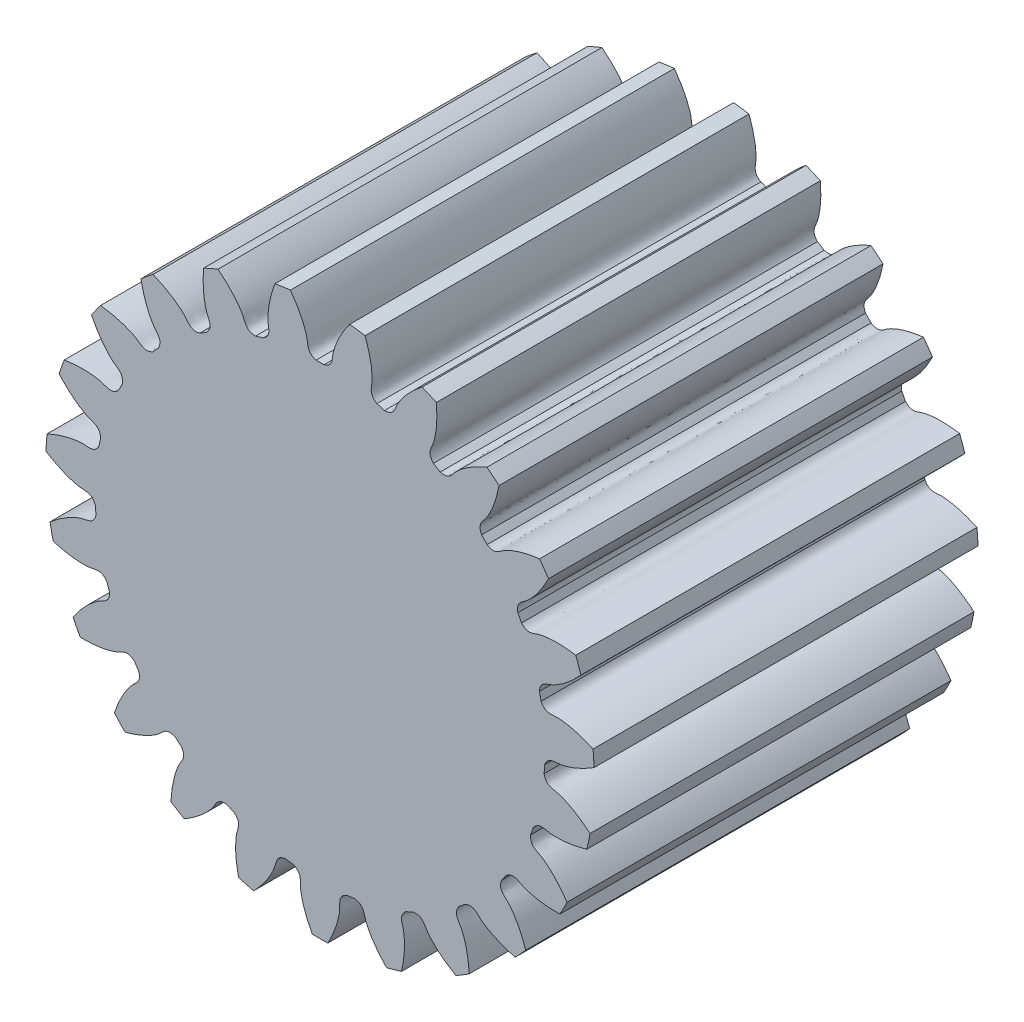
from build123d import *

# Parameters (mm, degrees)
SKETCH_1_R               = 12.5
EXTRUDE_1_DEPTH          = 30
CUT_EXTRUDE_1_DEPTH      = 35.820970693
PATTERN_CIRCULAR_1_COUNT = 23
SKETCH_4_R               = 23.884831792
CUT_EXTRUDE_2_DEPTH      = 12.5


with BuildPart() as part:
    # 草图1 → 凸台-拉伸1 (new body)
    with BuildSketch(Plane.XY):
        Circle(SKETCH_1_R)
    extrude(amount=EXTRUDE_1_DEPTH)

    # 草图2 → 切除-拉伸1 (cut, through all)
    with BuildSketch(Plane.XY):
        with BuildLine():
            ThreePointArc((0.181377653, 10.248395101), (0, 10.25), (-0.181377653, 10.248395101))
            add(Edge.make_bspline(
                [(-0.181377653, 10.248395101), (-0.577733486, 10.366762974), (-0.543760308, 10.63383717), (-0.592929934, 10.897175969), (-0.599497923, 10.928924648), (-0.607662079, 10.964750021), (-0.617581589, 11.004600593), (-0.629422247, 11.048418382), (-0.643345631, 11.096140951), (-0.659512363, 11.147700822), (-0.678080917, 11.203025719), (-0.699207817, 11.262038556), (-0.723047409, 11.324657509), (-0.749751766, 11.390796064), (-0.77947055, 11.460363083), (-0.812350892, 11.53326286), (-0.848537271, 11.609395193), (-0.888171388, 11.688655445), (-0.931392054, 11.77093462), (-0.978335067, 11.85611944), (-1.029133098, 11.944092416), (-1.083915577, 12.034731933), (-1.142808585, 12.127912332), (-1.205934738, 12.223503996), (-1.273413083, 12.321373437), (-1.345358995, 12.421383392), (-1.42188407, 12.523392912), (-1.503096023, 12.627257463), (-1.589098596, 12.732829022), (-1.679991457, 12.839956181), (-1.775870106, 12.94848425), (-1.876825788, 13.058255364), (-1.982945401, 13.169108593), (-2.094311412, 13.28088005), (-2.211001774, 13.393403009), (-2.333089845, 13.506508017), (-2.460644312, 13.620023012), (-2.59372912, 13.733773443), (-2.732403367, 13.847582394), (-2.927091206, 14.000950144), (-3.078290454, 14.112796156), (-3.181680766, 14.186195552)],
                knots=[0, 0, 0, 0, 0.147386897, 0.152959532, 0.159389495, 0.166676786, 0.174821406, 0.183823355, 0.193682632, 0.204399237, 0.21597317, 0.228404432, 0.241693023, 0.255838942, 0.270842189, 0.286702764, 0.303420668, 0.320995901, 0.339428462, 0.358718351, 0.378865568, 0.399870114, 0.421731989, 0.444451192, 0.468027723, 0.492461582, 0.517752771, 0.543901287, 0.570907132, 0.598770305, 0.627490807, 0.657068637, 0.687503795, 0.718796282, 0.750946098, 0.783953241, 0.817817713, 0.852539514, 0.888118643, 0.9245551, 1, 1, 1, 1], degree=3))
            ThreePointArc((-3.181680766, 14.186195552), (0, 14.538611926), (3.181680766, 14.186195552))
            add(Edge.make_bspline(
                [(0.181377653, 10.248395101), (0.577733486, 10.366762974), (0.543760308, 10.63383717), (0.592929934, 10.897175969), (0.599497923, 10.928924648), (0.607662079, 10.964750021), (0.617581589, 11.004600593), (0.629422247, 11.048418382), (0.643345631, 11.096140951), (0.659512363, 11.147700822), (0.678080917, 11.203025719), (0.699207817, 11.262038556), (0.723047409, 11.324657509), (0.749751766, 11.390796064), (0.77947055, 11.460363083), (0.812350892, 11.53326286), (0.848537271, 11.609395193), (0.888171388, 11.688655445), (0.931392054, 11.77093462), (0.978335067, 11.85611944), (1.029133098, 11.944092416), (1.083915577, 12.034731933), (1.142808585, 12.127912332), (1.205934738, 12.223503996), (1.273413083, 12.321373437), (1.345358995, 12.421383392), (1.42188407, 12.523392912), (1.503096023, 12.627257463), (1.589098596, 12.732829022), (1.679991457, 12.839956181), (1.775870106, 12.94848425), (1.876825788, 13.058255364), (1.982945401, 13.169108593), (2.094311412, 13.28088005), (2.211001774, 13.393403009), (2.333089845, 13.506508017), (2.460644312, 13.620023012), (2.59372912, 13.733773443), (2.732403367, 13.847582394), (2.927091206, 14.000950144), (3.078290454, 14.112796156), (3.181680766, 14.186195552)],
                knots=[0, 0, 0, 0, 0.147386897, 0.152959532, 0.159389495, 0.166676786, 0.174821406, 0.183823355, 0.193682632, 0.204399237, 0.21597317, 0.228404432, 0.241693023, 0.255838942, 0.270842189, 0.286702764, 0.303420668, 0.320995901, 0.339428462, 0.358718351, 0.378865568, 0.399870114, 0.421731989, 0.444451192, 0.468027723, 0.492461582, 0.517752771, 0.543901287, 0.570907132, 0.598770305, 0.627490807, 0.657068637, 0.687503795, 0.718796282, 0.750946098, 0.783953241, 0.817817713, 0.852539514, 0.888118643, 0.9245551, 1, 1, 1, 1], degree=3))
        make_face()
    cut_extrude_1 = extrude(amount=CUT_EXTRUDE_1_DEPTH, mode=Mode.SUBTRACT)

    # 阵列(圆周)1: 切除-拉伸1 ×23 about axis
    pattern_circular_1_axis = Axis((0, 0, -1.5), (0, 0, 1))
    for i in range(1, PATTERN_CIRCULAR_1_COUNT):
        add(cut_extrude_1.rotate(pattern_circular_1_axis, i * 360 / PATTERN_CIRCULAR_1_COUNT), mode=Mode.SUBTRACT)

    # 草图4 → 切除-拉伸2 (cut)
    with BuildSketch(Plane.XY.offset(30)):
        Circle(SKETCH_4_R)
    extrude(amount=-CUT_EXTRUDE_2_DEPTH, mode=Mode.SUBTRACT)


solid = part.part
